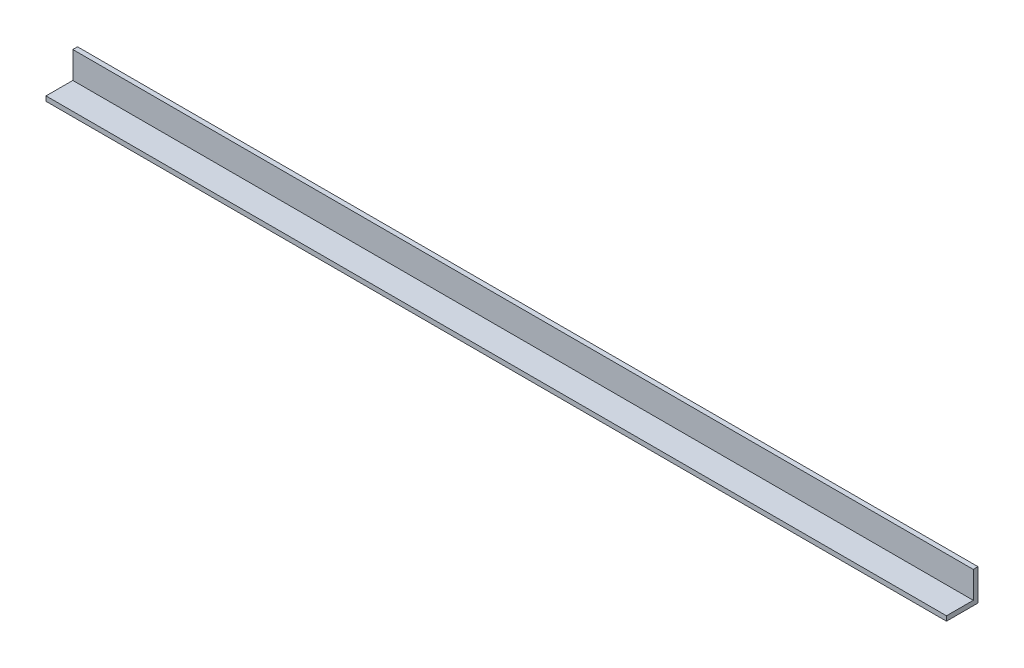
from build123d import *

# Parameters (mm, degrees)
SKETCH_1_W          = 2286
SKETCH_1_H          = 80
EXTRUDE_1_DEPTH     = 80
SKETCH_3_W          = 68
SKETCH_3_H          = 68
CUT_EXTRUDE_2_DEPTH = 2289.797937783


with BuildPart() as part:
    # 草图1 → 拉伸1 (new body)
    with BuildSketch(Plane.XY):
        with Locations((1143, 40)):
            Rectangle(SKETCH_1_W, SKETCH_1_H)
    extrude(amount=EXTRUDE_1_DEPTH)

    # 草图3 → 拉伸2 (cut, through all)
    with BuildSketch(Plane.ZY):
        with Locations((46, 46)):
            Rectangle(SKETCH_3_W, SKETCH_3_H)
    extrude(amount=-CUT_EXTRUDE_2_DEPTH, mode=Mode.SUBTRACT)


solid = part.part
